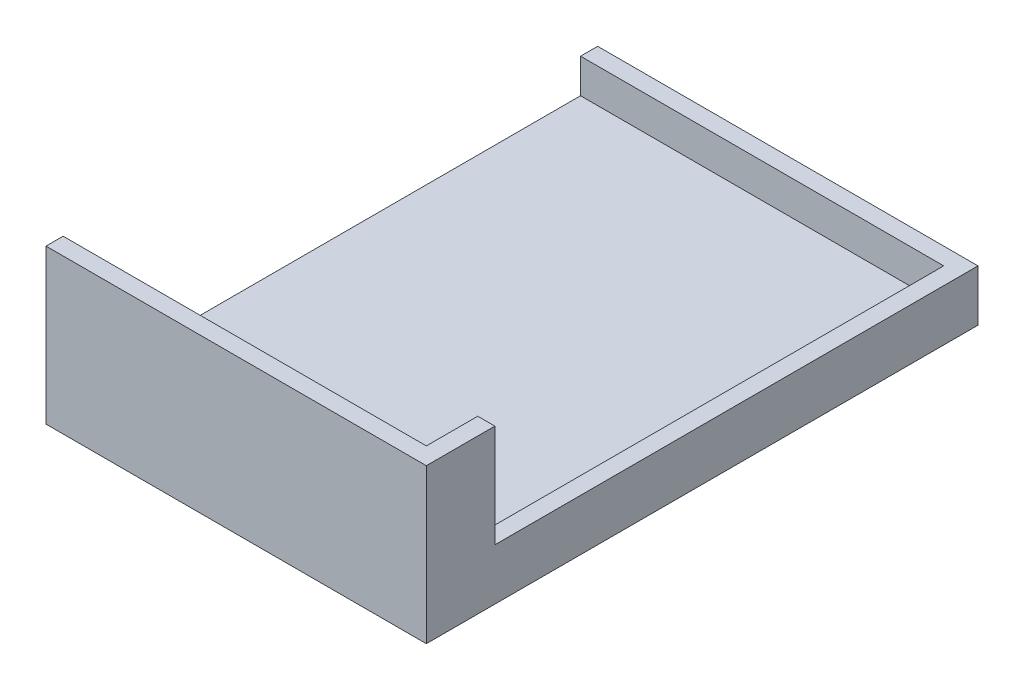
from build123d import *

# Parameters (mm, degrees)
SKETCH1_W           = 70.485
SKETCH1_H           = 102.235
BOSS_EXTRUDE1_DEPTH = 28.575
SHELL1_T            = -3.175
SKETCH2_W           = 89.535
SKETCH2_H           = 19.05
CUT_EXTRUDE1_DEPTH  = 3.175
SKETCH3_W           = 67.31
SKETCH3_H           = 19.05
CUT_EXTRUDE2_DEPTH  = 3.175


with BuildPart() as part:
    # Sketch1 → Boss-Extrude1 (new body)
    with BuildSketch(Plane(origin=(0, 0, 0), x_dir=(1, 0, 0), z_dir=(0, 1, 0))):
        with Locations((0.4325, 0.0575)):
            Rectangle(SKETCH1_W, SKETCH1_H)
    extrude(amount=BOSS_EXTRUDE1_DEPTH)

    # Shell1
    shell1_openings = [part.faces().sort_by_distance(p)[0] for p in [
        (0.4325, 28.575, -0.0575),
        (-34.81, 14.2875, -0.0575),
    ]]
    offset(amount=SHELL1_T, openings=shell1_openings, kind=Kind.INTERSECTION)

    # Sketch2 → Cut-Extrude1 (cut)
    with BuildSketch(Plane(origin=(35.675, 0, 0), x_dir=(0, 0, -1), z_dir=(1, 0, 0))):
        with Locations((6.4075, 19.05)):
            Rectangle(SKETCH2_W, SKETCH2_H)
    extrude(amount=-CUT_EXTRUDE1_DEPTH, mode=Mode.SUBTRACT)

    # Sketch3 → Cut-Extrude2 (cut)
    with BuildSketch(Plane(origin=(0, 0, -51.175), x_dir=(-1, 0, 0), z_dir=(0, 0, -1))):
        with Locations((1.155, 19.05)):
            Rectangle(SKETCH3_W, SKETCH3_H)
    extrude(amount=-CUT_EXTRUDE2_DEPTH, mode=Mode.SUBTRACT)


solid = part.part
